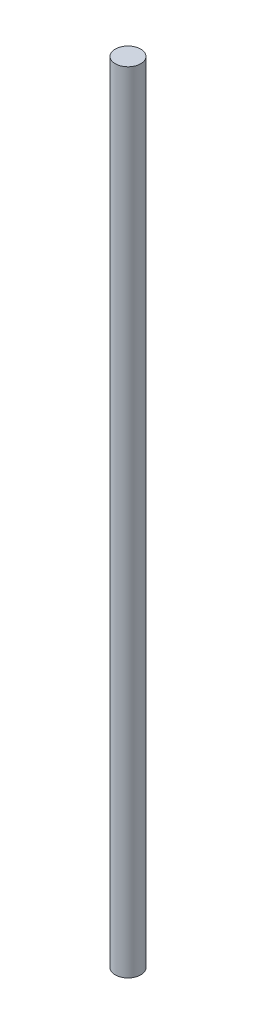
from build123d import *

# Parameters (mm, degrees)
SKETCH_1_R      = 1
EXTRUDE_1_DEPTH = 62


with BuildPart() as part:
    # 草图1 → 凸台-拉伸1 (new body)
    with BuildSketch(Plane(origin=(0, 0, 0), x_dir=(1, 0, 0), z_dir=(0, 1, 0))):
        with Locations(Location((0, 0, 0), (0, 0, 270))):
            Circle(SKETCH_1_R)
    extrude(amount=EXTRUDE_1_DEPTH)


solid = part.part
